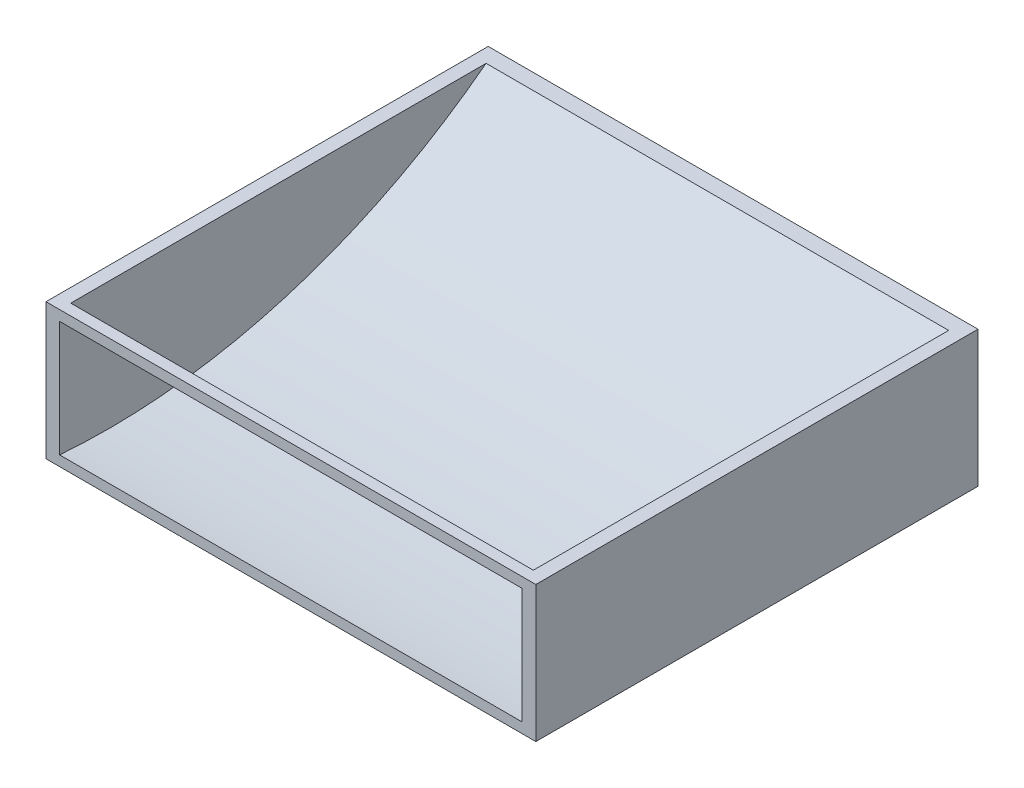
from build123d import *

# Parameters (mm, degrees)
SKETCH1_W           = 700
SKETCH1_H           = 200
BOSS_EXTRUDE1_DEPTH = 650
CUT_EXTRUDE2_DEPTH  = 680
SKETCH7_W           = 650
SKETCH7_H           = 200
BOSS_EXTRUDE3_DEPTH = 20


with BuildPart() as part:
    # Sketch1 → Boss-Extrude1 (new body)
    with BuildSketch(Plane.XY):
        Rectangle(SKETCH1_W, SKETCH1_H)
    extrude(amount=-BOSS_EXTRUDE1_DEPTH)

    # Sketch6 → Cut-Extrude2 (cut)
    with BuildSketch(Plane(origin=(350, 0, 0), x_dir=(0, 0, -1), z_dir=(1, 0, 0))):
        with BuildLine():
            Line((0, 85), (0, -85))
            ThreePointArc((0, -85), (330.583898703, -50.56807643), (626.895433751, 100))
            Line((626.895433751, 100), (16.346883748, 100))
            ThreePointArc((16.346883748, 100), (11.280043592, 89.114449525), (0, 85))
        make_face()
    extrude(amount=-CUT_EXTRUDE2_DEPTH, mode=Mode.SUBTRACT)

    # Sketch7 → Boss-Extrude3 (add)
    with BuildSketch(Plane(origin=(350, 0, 0), x_dir=(0, 0, -1), z_dir=(1, 0, 0))):
        with Locations((325, 0)):
            Rectangle(SKETCH7_W, SKETCH7_H)
    extrude(amount=BOSS_EXTRUDE3_DEPTH)


solid = part.part
